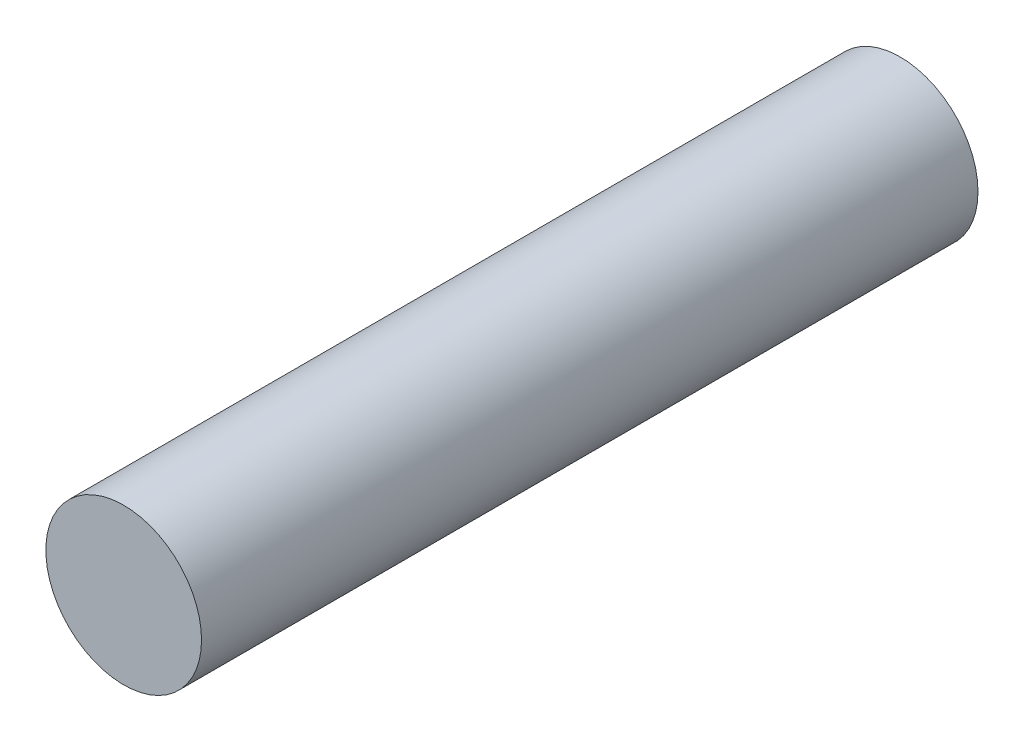
from build123d import *

# Parameters (mm, degrees)
SKETCH1_R           = 3.175
BOSS_EXTRUDE1_DEPTH = 26.59
SKETCH2_R           = 3.175
BOSS_EXTRUDE2_DEPTH = 5.08


with BuildPart() as part:
    # Sketch1 → Boss-Extrude1 (new body)
    with BuildSketch(Plane.XY):
        Circle(SKETCH1_R)
    extrude(amount=BOSS_EXTRUDE1_DEPTH)

    # Sketch2 → Boss-Extrude2 (add)
    with BuildSketch(Plane.XY.offset(26.59)):
        Circle(SKETCH2_R)
    extrude(amount=BOSS_EXTRUDE2_DEPTH)


solid = part.part
